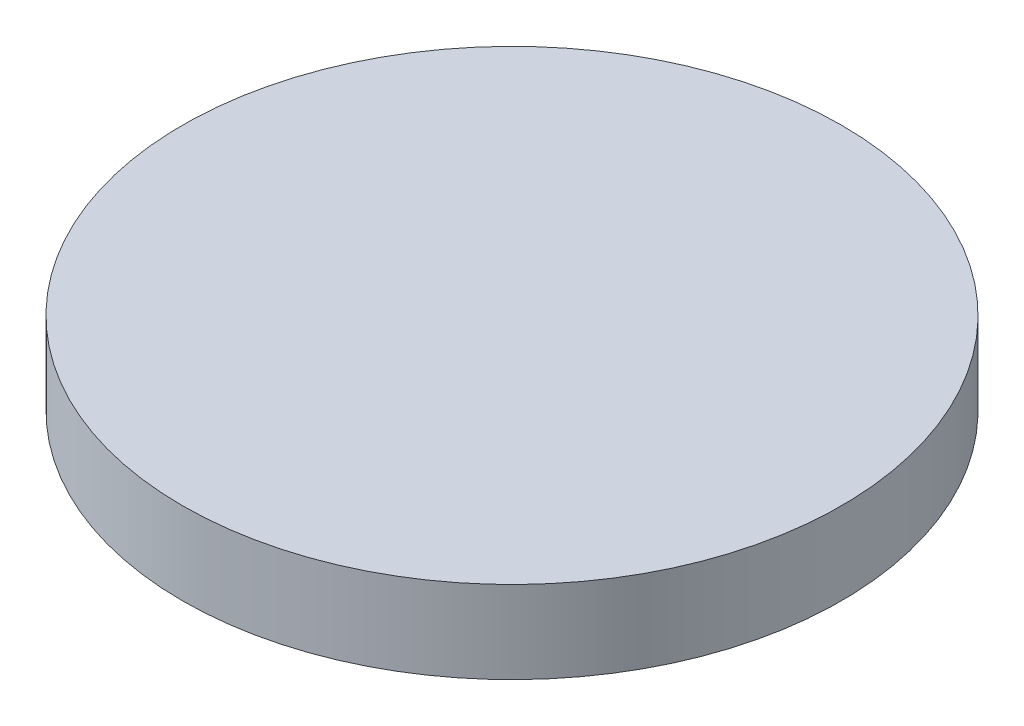
from build123d import *

# Parameters (mm, degrees)
SKETCH1_R           = 76.2
BOSS_EXTRUDE1_DEPTH = 19.05


with BuildPart() as part:
    # Sketch1 → Boss-Extrude1 (new body)
    with BuildSketch(Plane(origin=(0, 0, 0), x_dir=(1, 0, 0), z_dir=(0, 1, 0))):
        with Locations(Location((0, 0, 0), (0, 0, 90))):
            Circle(SKETCH1_R)
    extrude(amount=BOSS_EXTRUDE1_DEPTH)


solid = part.part
